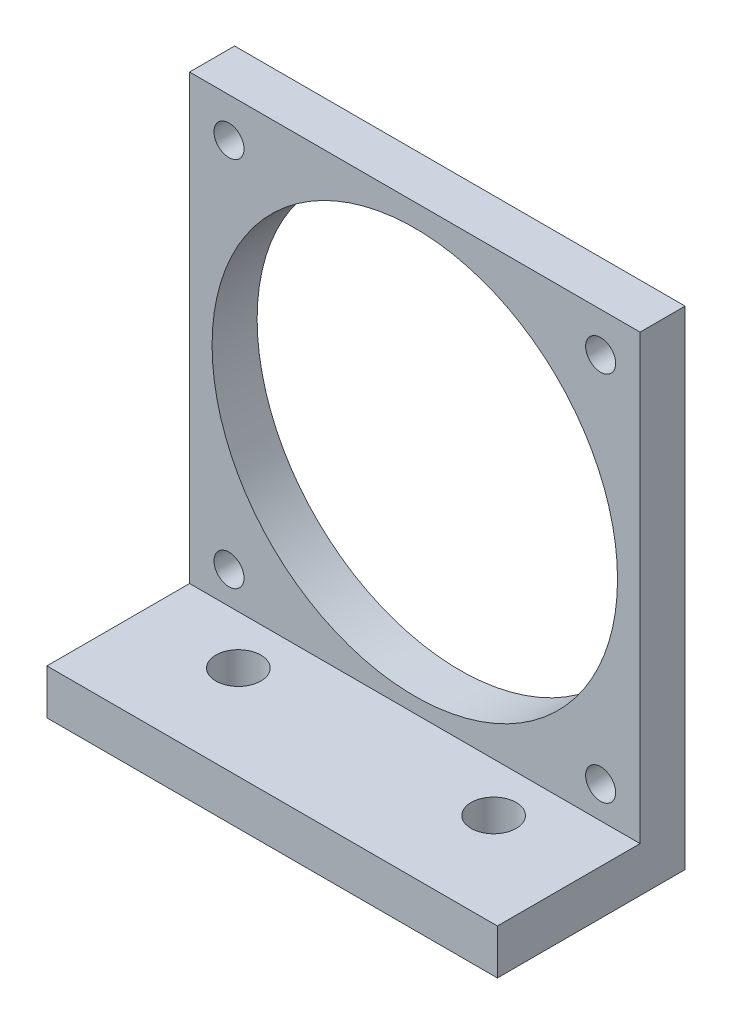
from build123d import *

# Parameters (mm, degrees)
SKETCH_1_W          = 60
SKETCH_1_H          = 65
EXTRUDE_1_DEPTH     = 6
SKETCH_2_W          = 60
SKETCH_2_H          = 6
EXTRUDE_2_DEPTH     = 19
CUT_EXTRUDE_2_REACH = 93.924
SKETCH_4_R          = 3
CUT_EXTRUDE_3_REACH = 93.924
SKETCH_3_R          = 27
SKETCH_3_R_2        = 2


with BuildPart() as part:
    # 草圖1 → 填料-伸長1 (new body)
    with BuildSketch(Plane.XY):
        with Locations((30, 32.5)):
            Rectangle(SKETCH_1_W, SKETCH_1_H)
    extrude(amount=EXTRUDE_1_DEPTH)

    # 草圖2 → 填料-伸長2 (add)
    with BuildSketch(Plane.XY.offset(6)):
        with Locations((30, 3)):
            Rectangle(SKETCH_2_W, SKETCH_2_H)
    extrude(amount=EXTRUDE_2_DEPTH)

    # 草圖4 → 除料-伸長2 (cut, up to next)
    with BuildSketch(Plane(origin=(0, 0, 0), x_dir=(-1, 0, 0), z_dir=(0, -1, 0)), mode=Mode.PRIVATE) as cut_extrude_2_sk1:
        with Locations(Location((-13, -12.5, 0), (0, 0, 90))):
            Circle(SKETCH_4_R)
    cut_extrude_2_tool1 = extrude(cut_extrude_2_sk1.sketch, amount=-CUT_EXTRUDE_2_REACH, mode=Mode.PRIVATE) & part.part
    # 草圖4 → 除料-伸長2 (cut, up to next)
    with BuildSketch(Plane(origin=(0, 0, 0), x_dir=(-1, 0, 0), z_dir=(0, -1, 0)), mode=Mode.PRIVATE) as cut_extrude_2_sk2:
        with Locations(Location((-47, -12.5, 0), (0, 0, 90))):
            Circle(SKETCH_4_R)
    cut_extrude_2_tool2 = extrude(cut_extrude_2_sk2.sketch, amount=-CUT_EXTRUDE_2_REACH, mode=Mode.PRIVATE) & part.part
    add(cut_extrude_2_tool1.solids().sort_by_distance((13, 0, 12.5))[0], mode=Mode.SUBTRACT)
    add(cut_extrude_2_tool2.solids().sort_by_distance((47, 0, 12.5))[0], mode=Mode.SUBTRACT)

    # 草圖3 → 除料-伸長3 (cut, up to next)
    with BuildSketch(Plane(origin=(0, 0, 0), x_dir=(-1, 0, 0), z_dir=(0, 0, -1)), mode=Mode.PRIVATE) as cut_extrude_3_sk1:
        with Locations((-30, 35)):
            Circle(SKETCH_3_R)
    cut_extrude_3_tool1 = extrude(cut_extrude_3_sk1.sketch, amount=-CUT_EXTRUDE_3_REACH, mode=Mode.PRIVATE) & part.part
    # 草圖3 → 除料-伸長3 (cut, up to next)
    with BuildSketch(Plane(origin=(0, 0, 0), x_dir=(-1, 0, 0), z_dir=(0, 0, -1)), mode=Mode.PRIVATE) as cut_extrude_3_sk2:
        with Locations((-54.748737342, 59.748737342)):
            Circle(SKETCH_3_R_2)
    cut_extrude_3_tool2 = extrude(cut_extrude_3_sk2.sketch, amount=-CUT_EXTRUDE_3_REACH, mode=Mode.PRIVATE) & part.part
    # 草圖3 → 除料-伸長3 (cut, up to next)
    with BuildSketch(Plane(origin=(0, 0, 0), x_dir=(-1, 0, 0), z_dir=(0, 0, -1)), mode=Mode.PRIVATE) as cut_extrude_3_sk3:
        with Locations((-5.251262658, 59.748737342)):
            Circle(SKETCH_3_R_2)
    cut_extrude_3_tool3 = extrude(cut_extrude_3_sk3.sketch, amount=-CUT_EXTRUDE_3_REACH, mode=Mode.PRIVATE) & part.part
    # 草圖3 → 除料-伸長3 (cut, up to next)
    with BuildSketch(Plane(origin=(0, 0, 0), x_dir=(-1, 0, 0), z_dir=(0, 0, -1)), mode=Mode.PRIVATE) as cut_extrude_3_sk4:
        with Locations((-54.748737342, 10.251262658)):
            Circle(SKETCH_3_R_2)
    cut_extrude_3_tool4 = extrude(cut_extrude_3_sk4.sketch, amount=-CUT_EXTRUDE_3_REACH, mode=Mode.PRIVATE) & part.part
    # 草圖3 → 除料-伸長3 (cut, up to next)
    with BuildSketch(Plane(origin=(0, 0, 0), x_dir=(-1, 0, 0), z_dir=(0, 0, -1)), mode=Mode.PRIVATE) as cut_extrude_3_sk5:
        with Locations((-5.251262658, 10.251262658)):
            Circle(SKETCH_3_R_2)
    cut_extrude_3_tool5 = extrude(cut_extrude_3_sk5.sketch, amount=-CUT_EXTRUDE_3_REACH, mode=Mode.PRIVATE) & part.part
    add(cut_extrude_3_tool1.solids().sort_by_distance((30, 35, 0))[0], mode=Mode.SUBTRACT)
    add(cut_extrude_3_tool2.solids().sort_by_distance((54.748737, 59.748737, 0))[0], mode=Mode.SUBTRACT)
    add(cut_extrude_3_tool3.solids().sort_by_distance((5.251263, 59.748737, 0))[0], mode=Mode.SUBTRACT)
    add(cut_extrude_3_tool4.solids().sort_by_distance((54.748737, 10.251263, 0))[0], mode=Mode.SUBTRACT)
    add(cut_extrude_3_tool5.solids().sort_by_distance((5.251263, 10.251263, 0))[0], mode=Mode.SUBTRACT)


solid = part.part
